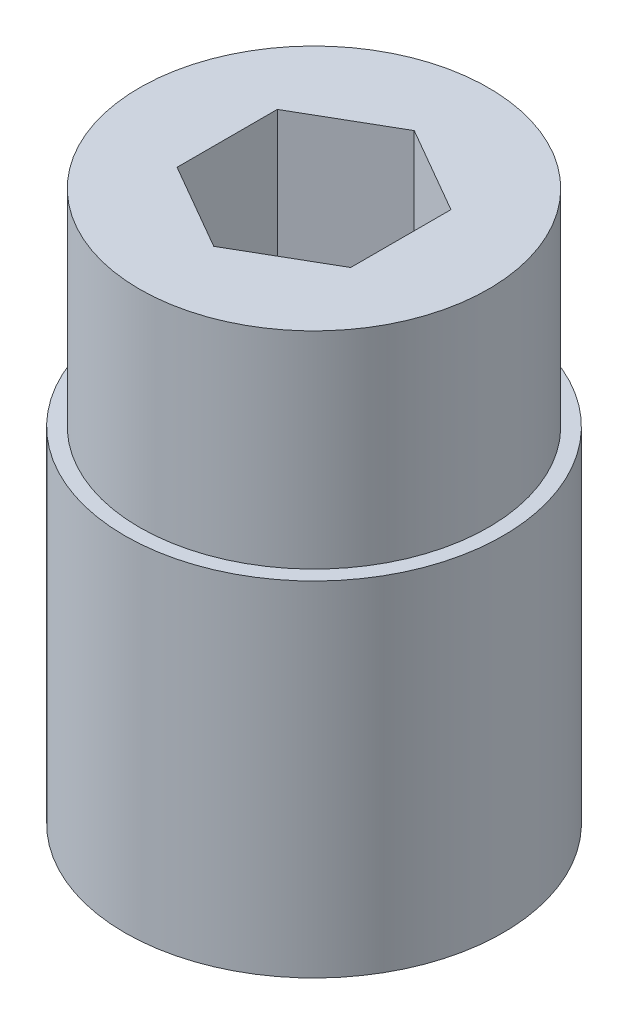
from build123d import *

# Parameters (mm, degrees)
SKETCH1_R           = 7
BOSS_EXTRUDE1_DEPTH = 10
SKETCH2_R           = 5.075
BOSS_EXTRUDE2_DEPTH = 6
CUT_EXTRUDE2_DEPTH  = 19.814887722
SKETCH5_OUTSIDE_W   = 21.092
SKETCH5_OUTSIDE_H   = 21.092
SKETCH5_OUTSIDE_R   = 5.5
CUT_EXTRUDE3_DEPTH  = 15.071247279


with BuildPart() as part:
    # Sketch1 → Boss-Extrude1 (new body)
    with BuildSketch(Plane(origin=(0, 0, 0), x_dir=(1, 0, 0), z_dir=(0, 1, 0))):
        with Locations(Location((0, 0, 0), (0, 0, 270))):
            Circle(SKETCH1_R)
    extrude(amount=BOSS_EXTRUDE1_DEPTH)

    # Sketch2 → Boss-Extrude2 (add)
    with BuildSketch(Plane(origin=(0, 10, 0), x_dir=(1, 0, 0), z_dir=(0, 1, 0))):
        with Locations(Location((0, 0, 0), (0, 0, 270))):
            Circle(SKETCH2_R)
    extrude(amount=BOSS_EXTRUDE2_DEPTH)

    # Sketch4 → Cut-Extrude2 (cut, through all)
    with BuildSketch(Plane(origin=(0, 16, 0), x_dir=(1, 0, 0), z_dir=(0, 1, 0))):
        Polygon((2.525, 1.45780943), (0, 2.915618859), (-2.525, 1.45780943), (-2.525, -1.45780943), (0, -2.915618859), (2.525, -1.45780943), align=None)
    extrude(amount=-CUT_EXTRUDE2_DEPTH, mode=Mode.SUBTRACT)

    # Sketch5 outside → Cut-Extrude3 (cut, through all)
    with BuildSketch(Plane(origin=(0, 10, 0), x_dir=(1, 0, 0), z_dir=(0, 1, 0))):
        Rectangle(SKETCH5_OUTSIDE_W, SKETCH5_OUTSIDE_H)
        with Locations(Location((0, 0, 0), (0, 0, 270))):
            Circle(SKETCH5_OUTSIDE_R, mode=Mode.SUBTRACT)
    extrude(amount=-CUT_EXTRUDE3_DEPTH, mode=Mode.SUBTRACT)


solid = part.part
